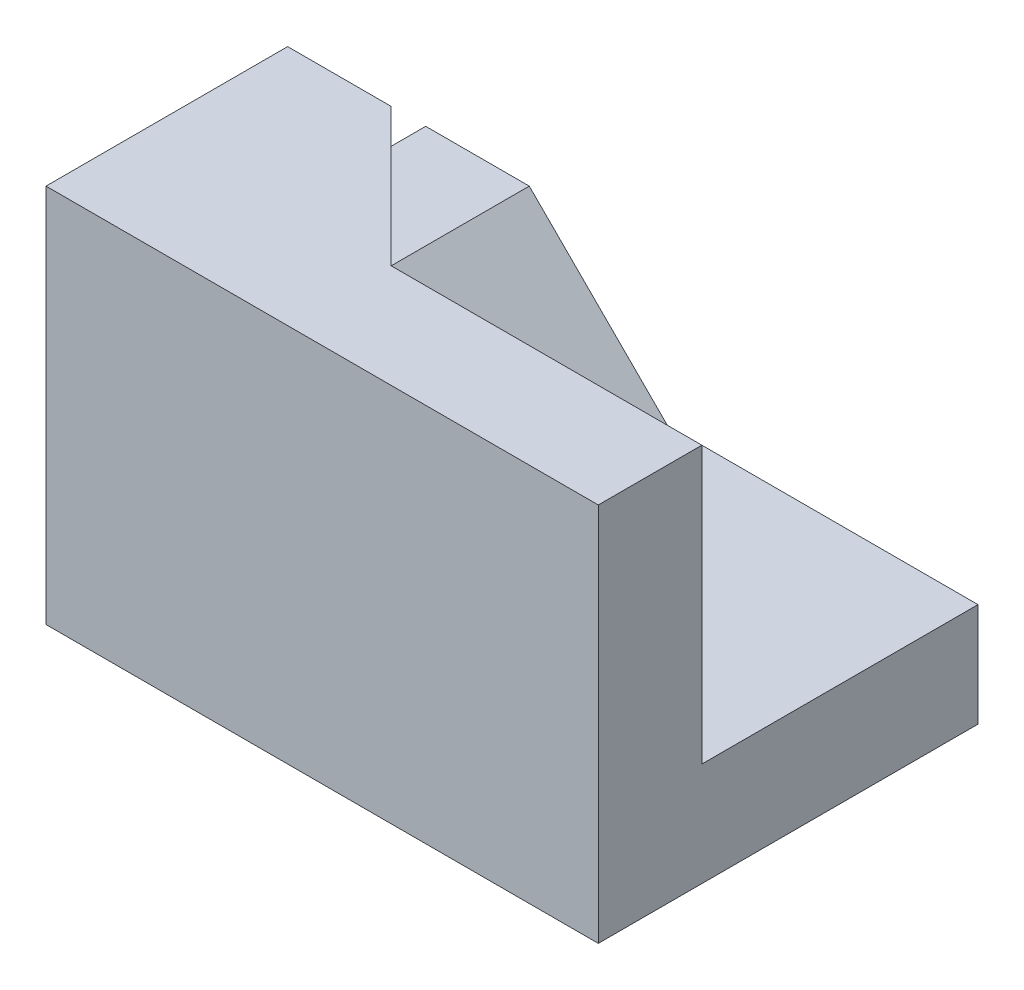
from build123d import *

# Parameters (mm, degrees)
SKETCH_3_W          = 80
SKETCH_3_H          = 55
EXTRUDE_2_DEPTH     = 55
SKETCH_4_W          = 40
SKETCH_4_H          = 40
CUT_EXTRUDE_2_DEPTH = 45
SKETCH_5_W          = 20
SKETCH_5_H          = 20
CUT_EXTRUDE_5_DEPTH = 15


with BuildPart() as part:
    # 草图3 → 凸台-拉伸2 (new body)
    with BuildSketch(Plane(origin=(0, 0, 0), x_dir=(1, 0, 0), z_dir=(0, 1, 0))):
        with Locations((40, 27.5)):
            Rectangle(SKETCH_3_W, SKETCH_3_H)
    extrude(amount=EXTRUDE_2_DEPTH)

    # 草图4 → 切除-拉伸2 (cut)
    with BuildSketch(Plane(origin=(80, 0, 0), x_dir=(0, 0, -1), z_dir=(1, 0, 0))):
        with Locations((35, 35)):
            Rectangle(SKETCH_4_W, SKETCH_4_H)
    extrude(amount=-CUT_EXTRUDE_2_DEPTH, mode=Mode.SUBTRACT)

    # 草图5 → 切除-拉伸5 (cut)
    with BuildSketch(Plane.ZY):
        with Locations((-45, 45)):
            Rectangle(SKETCH_5_W, SKETCH_5_H)
    extrude(amount=-CUT_EXTRUDE_5_DEPTH, mode=Mode.SUBTRACT)

    # loft from a face of the part (loft_11)
    loft([part.faces().sort_by_distance((35, 35, -35))[0], part.faces().sort_by_distance((15, 45, -45))[0]], mode=Mode.SUBTRACT)


solid = part.part
